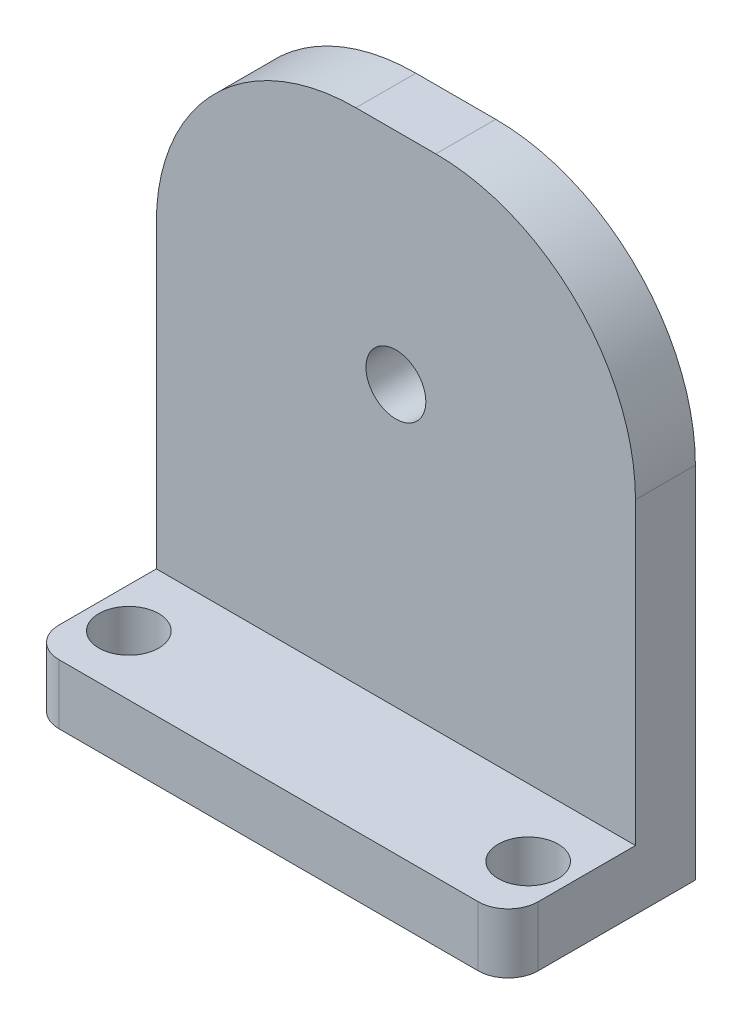
from build123d import *

# Parameters (mm, degrees)
SKETCH1_W           = 24
SKETCH1_H           = 3.375672593
SKETCH1_R           = 1.5
BOSS_EXTRUDE1_DEPTH = 3
SKETCH2_W           = 24
SKETCH2_H           = 3
BOSS_EXTRUDE2_DEPTH = 25
FILLET1_R           = 10
SKETCH3_R           = 1.5
CUT_EXTRUDE1_DEPTH  = 32.123129679


with BuildPart() as part:
    # Sketch1 → Boss-Extrude1 (new body)
    # profile 1 of 2: a face of its own
    with BuildSketch(Plane(origin=(0, 0, 0), x_dir=(1, 0, 0), z_dir=(0, 1, 0))):
        with Locations((0, 4.687836297)):
            Rectangle(SKETCH1_W, SKETCH1_H)
    # profile 2 of 2: a face of its own
    with BuildSketch(Plane(origin=(0, 0, 0), x_dir=(1, 0, 0), z_dir=(0, 1, 0))):
        with BuildLine():
            ThreePointArc((-10.5, -3), (-11.560660172, -2.560660172), (-12, -1.5))
            Line((-12, -1.5), (-12, 3))
            Line((-12, 3), (12, 3))
            Line((12, 3), (12, -1.5))
            ThreePointArc((12, -1.5), (11.560660172, -2.560660172), (10.5, -3))
            Line((10.5, -3), (-10.5, -3))
        make_face()
        with Locations(Location((10, 0, 0), (0, 0, 270))):
            Circle(SKETCH1_R, mode=Mode.SUBTRACT)
        with Locations(Location((-10, 0, 0), (0, 0, 270))):
            Circle(SKETCH1_R, mode=Mode.SUBTRACT)
    extrude(amount=BOSS_EXTRUDE1_DEPTH)

    # Sketch2 → Boss-Extrude2 (add)
    with BuildSketch(Plane(origin=(0, 3, 0), x_dir=(1, 0, 0), z_dir=(0, 1, 0))):
        with Locations((0, 4.875672593)):
            Rectangle(SKETCH2_W, SKETCH2_H)
    extrude(amount=BOSS_EXTRUDE2_DEPTH)

    # Fillet1
    fillet1_edges = [part.edges().sort_by_distance(p)[0] for p in [
        (12, 28, -4.875672593),
        (-12, 28, -4.875672593),
    ]]
    fillet(fillet1_edges, radius=FILLET1_R)

    # Sketch3 → Cut-Extrude1 (cut, through all)
    with BuildSketch(Plane.XY.offset(-3.375672593)):
        with Locations((0, 17)):
            Circle(SKETCH3_R)
    extrude(amount=-CUT_EXTRUDE1_DEPTH, mode=Mode.SUBTRACT)


solid = part.part
